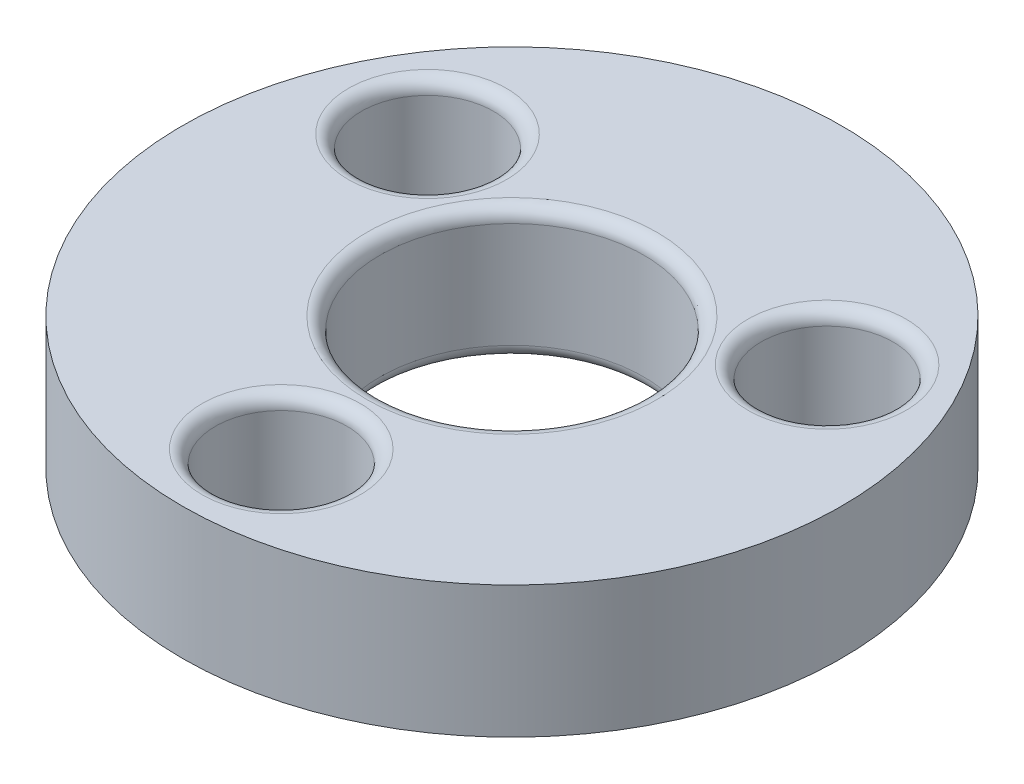
from build123d import *

# Parameters (mm, degrees)
SKETCH1_R           = 25
SKETCH1_R_2         = 10
BOSS_EXTRUDE1_DEPTH = 10
SKETCH2_R           = 5
CUT_EXTRUDE1_DEPTH  = 10
FILLET1_R           = 1


with BuildPart() as part:
    # Sketch1 → Boss-Extrude1 (new body)
    with BuildSketch(Plane(origin=(0, 0, 0), x_dir=(1, 0, 0), z_dir=(0, 1, 0))):
        with Locations(Location((0, 0, 0), (0, 0, 270))):
            Circle(SKETCH1_R)
        with Locations(Location((0, 0, 0), (0, 0, 270))):
            Circle(SKETCH1_R_2, mode=Mode.SUBTRACT)
    extrude(amount=BOSS_EXTRUDE1_DEPTH)

    # Sketch2 → Cut-Extrude1 (cut)
    with BuildSketch(Plane.XZ):
        with Locations(Location((0, 17.5, 0), (0, 0, 270))):
            Circle(SKETCH2_R)
        with Locations(Location((15.155444566, -8.75, 0), (0, 0, 270))):
            Circle(SKETCH2_R)
        with Locations(Location((-15.155444566, -8.75, 0), (0, 0, 270))):
            Circle(SKETCH2_R)
    extrude(amount=-CUT_EXTRUDE1_DEPTH, mode=Mode.SUBTRACT)

    # Fillet1
    fillet1_edges = [part.edges().sort_by_distance(p)[0] for p in [
        (0, 10, 22.5),
        (0, 0, 22.5),
        (15.155444566, 10, -3.75),
        (15.155444566, 0, -3.75),
        (-15.155444566, 10, -3.75),
        (-15.155444566, 0, -3.75),
        (0, 0, -10),
        (0, 10, -10),
    ]]
    fillet(fillet1_edges, radius=FILLET1_R)


solid = part.part
